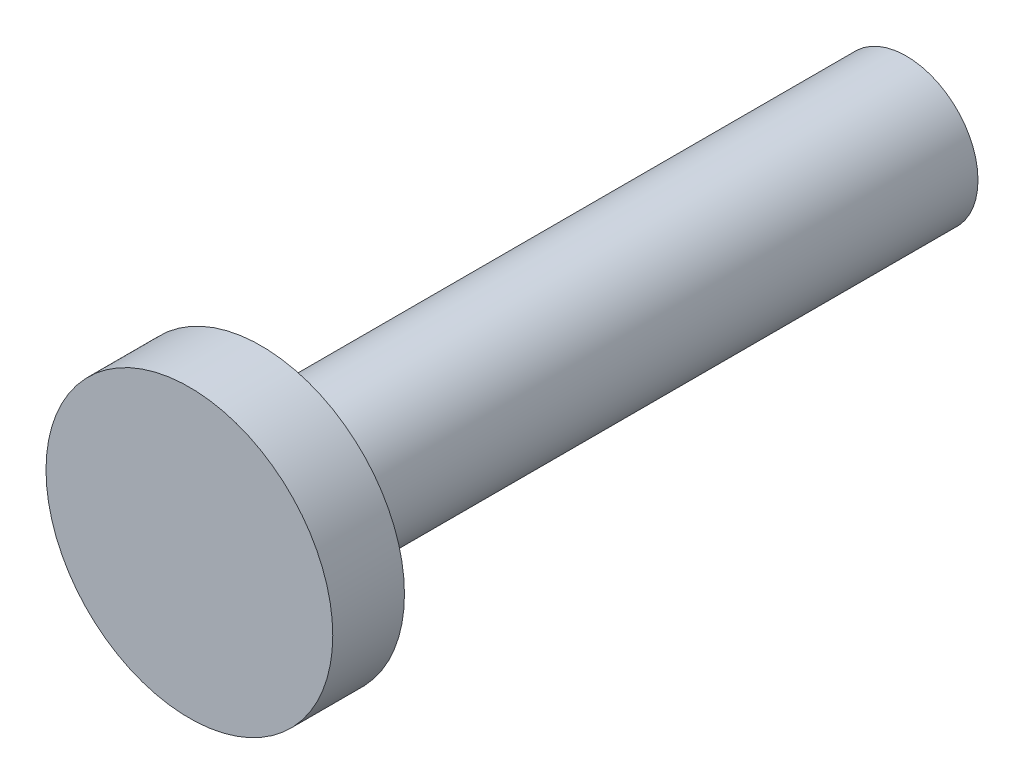
from build123d import *

# Parameters (mm, degrees)
SKETCH1_R           = 10
BOSS_EXTRUDE1_DEPTH = 5
SKETCH2_R           = 5
BOSS_EXTRUDE2_DEPTH = 45


with BuildPart() as part:
    # Sketch1 → Boss-Extrude1 (new body)
    with BuildSketch(Plane.XY):
        Circle(SKETCH1_R)
    extrude(amount=BOSS_EXTRUDE1_DEPTH)

    # Sketch2 → Boss-Extrude2 (add)
    with BuildSketch(Plane(origin=(0, 0, 0), x_dir=(-1, 0, 0), z_dir=(0, 0, -1))):
        with Locations(Location((0, 0, 0), (0, 0, 180))):
            Circle(SKETCH2_R)
    extrude(amount=BOSS_EXTRUDE2_DEPTH)


solid = part.part
